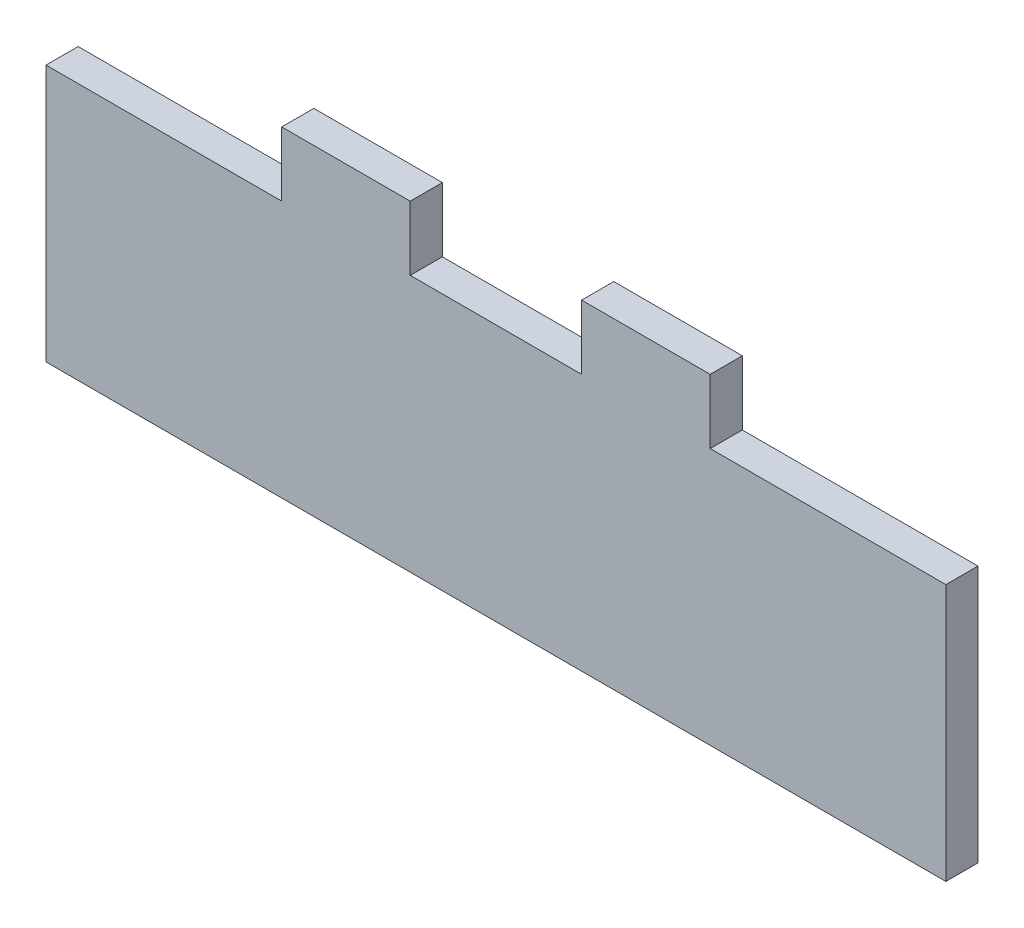
from build123d import *

# Parameters (mm, degrees)
SKETCH1_W           = 70
SKETCH1_H           = 20
SKETCH1_W_2         = 10
SKETCH1_H_2         = 5
BOSS_EXTRUDE1_DEPTH = 2.5


with BuildPart() as part:
    # Sketch1 → Boss-Extrude1 (new body)
    with BuildSketch(Plane.XY):
        Rectangle(SKETCH1_W, SKETCH1_H)
        with Locations((-11.666666667, 12.5)):
            Rectangle(SKETCH1_W_2, SKETCH1_H_2)
        with Locations((11.666666667, 12.5)):
            Rectangle(SKETCH1_W_2, SKETCH1_H_2)
    extrude(amount=BOSS_EXTRUDE1_DEPTH)


solid = part.part
